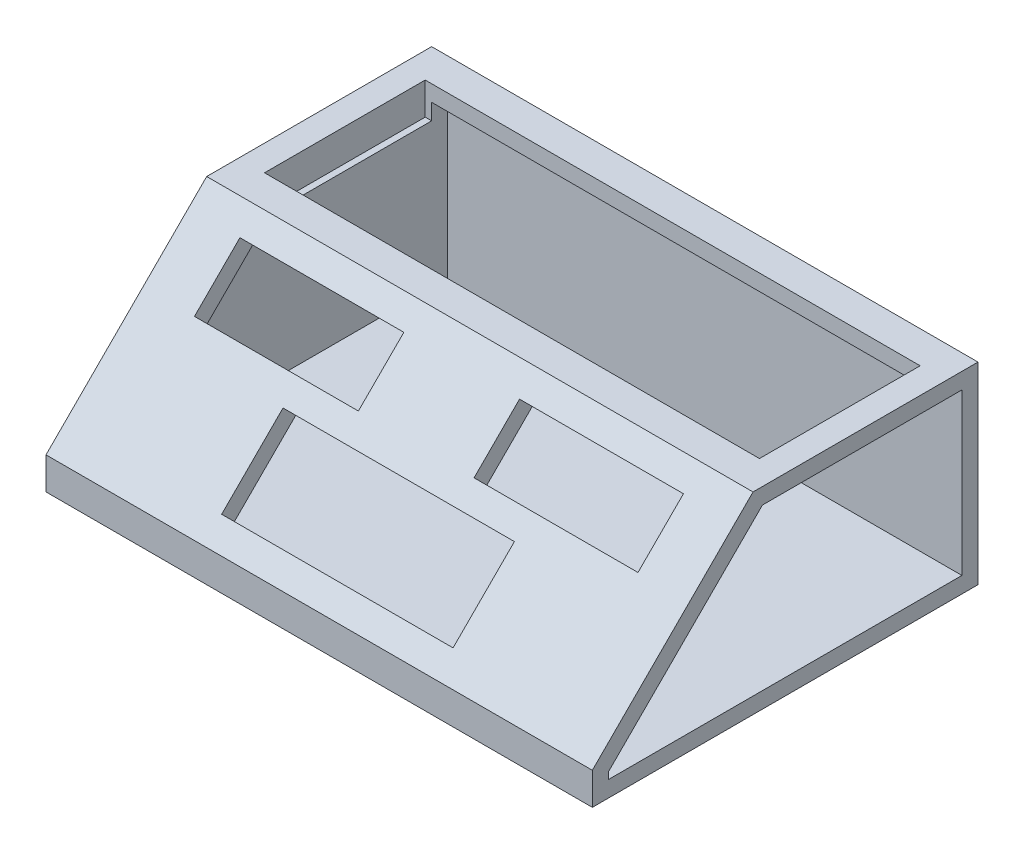
from build123d import *

# Parameters (mm, degrees)
BOSS_EXTRUDE1_DEPTH = 170
SKETCH2_W           = 154
SKETCH2_H           = 50
CUT_EXTRUDE1_DEPTH  = 10
CUT_EXTRUDE2_DEPTH  = 160
SKETCH4_W           = 51
SKETCH4_H           = 20
SKETCH4_W_2         = 72
SKETCH4_H_2         = 27
CUT_EXTRUDE3_DEPTH  = 10


with BuildPart() as part:
    # Sketch1 → Boss-Extrude1 (new body)
    with BuildSketch(Plane(origin=(0, 0, 0), x_dir=(0, 0, -1), z_dir=(1, 0, 0))):
        Polygon((-54.32397065, 28.139382559), (15.67602935, 28.139382559), (15.67602935, -31.860617441), (-104.32397065, -31.860617441), (-104.32397065, -21.860617441), align=None)
    extrude(amount=BOSS_EXTRUDE1_DEPTH)

    # Sketch2 → Cut-Extrude1 (cut)
    with BuildSketch(Plane(origin=(0, 28.139382559, 0), x_dir=(1, 0, 0), z_dir=(0, 1, 0))):
        with Locations((85, -19.32397065)):
            Rectangle(SKETCH2_W, SKETCH2_H)
    extrude(amount=-CUT_EXTRUDE1_DEPTH, mode=Mode.SUBTRACT)

    # Sketch3 → Cut-Extrude2 (cut)
    with BuildSketch(Plane(origin=(170, 0, 0), x_dir=(0, 0, -1), z_dir=(1, 0, 0))):
        Polygon((-51.40243063, 23.139382559), (10.67602935, 23.139382559), (10.67602935, -26.860617441), (-99.32397065, -26.860617441), (-99.32397065, -24.782157461), align=None)
    extrude(amount=-CUT_EXTRUDE2_DEPTH, mode=Mode.SUBTRACT)

    # Sketch4 → Cut-Extrude3 (cut)
    with BuildSketch(Plane(origin=(0, 41.231676605, 41.231676605), x_dir=(1, 0, 0), z_dir=(0, 0.7071067811865474, 0.7071067811865477))):
        with Locations((41.5, -36.515299802)):
            Rectangle(SKETCH4_W, SKETCH4_H)
        with Locations((128.5, -36.515299802)):
            Rectangle(SKETCH4_W, SKETCH4_H)
        with Locations((85, -67.72597792)):
            Rectangle(SKETCH4_W_2, SKETCH4_H_2)
    extrude(amount=-CUT_EXTRUDE3_DEPTH, mode=Mode.SUBTRACT)


solid = part.part
